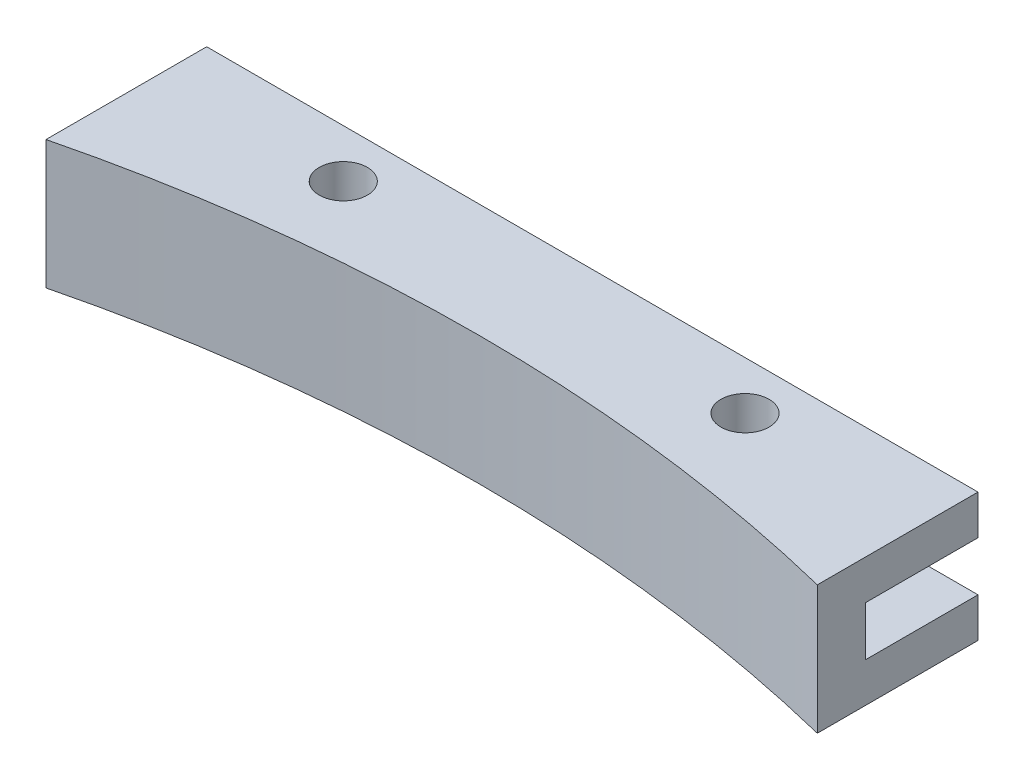
from build123d import *

# Parameters (mm, degrees)
BOSS_EXTRUDE1_DEPTH = 4
SKETCH10_R          = 1.5
SKETCH10_W          = 40
SKETCH10_H          = 6.922711204
CUT_EXTRUDE2_DEPTH  = 31.436460939
SKETCH11_W          = 48
SKETCH11_H          = 1.077288796
BOSS_EXTRUDE2_DEPTH = 8
SKETCH12_W          = 7
SKETCH12_H          = 3.075
CUT_EXTRUDE3_DEPTH  = 52.052699777


with BuildPart() as part:
    # Sketch1 → Boss-Extrude1 (new, symmetric)
    with BuildSketch(Plane(origin=(0, 0, 0), x_dir=(1, 0, 0), z_dir=(0, 1, 0))):
        with BuildLine():
            Line((-20, 0), (0, 0))
            Line((0, 0), (20, 0))
            Line((20, 0), (20, -8))
            Line((20, -8), (24, -8))
            Line((24, -8), (24, -16.922711204))
            ThreePointArc((24, -16.922711204), (0, -14), (-24, -16.922711204))
            Line((-24, -16.922711204), (-24, -8))
            Line((-24, -8), (-20, -8))
            Line((-20, -8), (-20, 0))
        make_face()
    extrude(amount=BOSS_EXTRUDE1_DEPTH, both=True)

    # Sketch10 → Cut-Extrude2 (cut, through all)
    with BuildSketch(Plane(origin=(0, 4, 0), x_dir=(1, 0, 0), z_dir=(0, 1, 0))):
        with Locations(Location((-12.5, -9.922711204, 0), (0, 0, 270))):
            Circle(SKETCH10_R)
        with Locations(Location((12.5, -9.922711204, 0), (0, 0, 270))):
            Circle(SKETCH10_R)
        with Locations((0, -3.461355602)):
            Rectangle(SKETCH10_W, SKETCH10_H)
    extrude(amount=-CUT_EXTRUDE2_DEPTH, mode=Mode.SUBTRACT)

    # Sketch11 → Boss-Extrude2 (add)
    with BuildSketch(Plane(origin=(0, 4, 0), x_dir=(1, 0, 0), z_dir=(0, 1, 0))):
        with Locations((0, -7.461355602)):
            Rectangle(SKETCH11_W, SKETCH11_H)
    extrude(amount=-BOSS_EXTRUDE2_DEPTH)

    # Sketch12 → Cut-Extrude3 (cut, through all)
    with BuildSketch(Plane.ZY.offset(24)):
        with Locations((10.422711204, 0)):
            Rectangle(SKETCH12_W, SKETCH12_H)
    extrude(amount=-CUT_EXTRUDE3_DEPTH, mode=Mode.SUBTRACT)


solid = part.part
